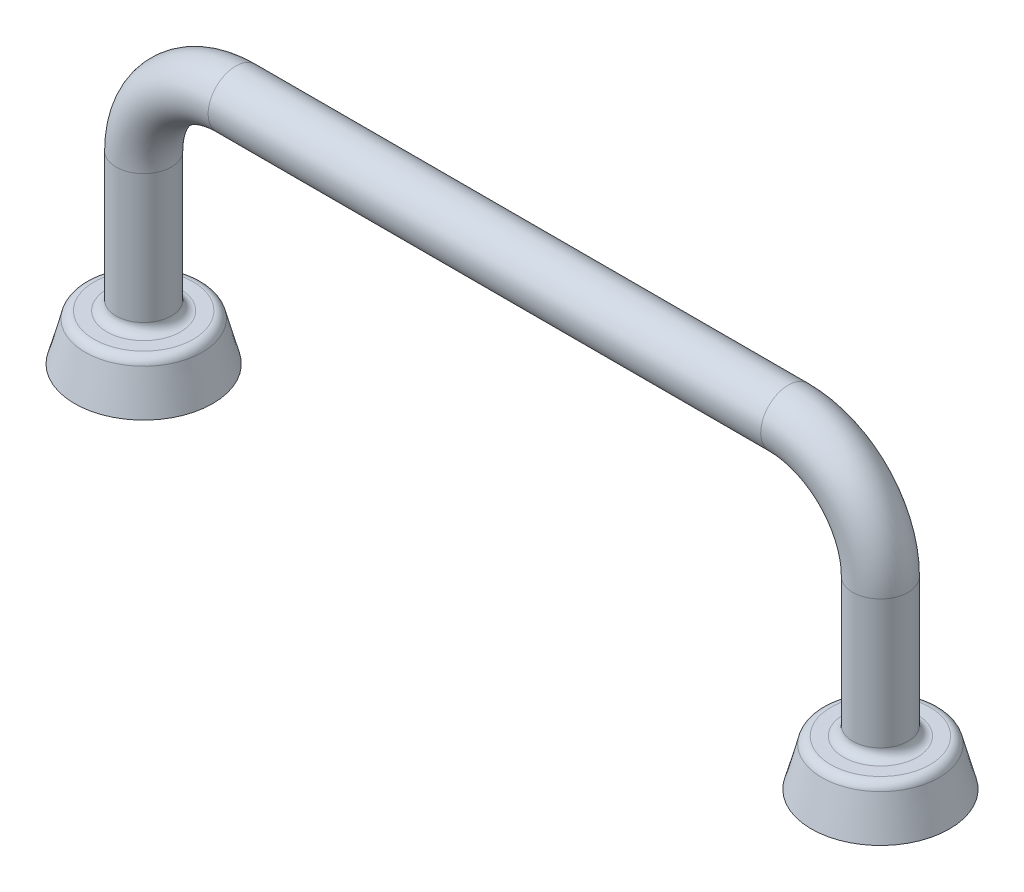
from build123d import *

# Parameters (mm, degrees)
SWEEP1_PROFILE_R              = 3
SKETCH10_R                    = 7.5
BOSS_EXTRUDE1_DEPTH           = 5
BOSS_EXTRUDE1_DRAFT           = -15
BOSS_EXTRUDE1_PROFILE_2_DEPTH = 5
BOSS_EXTRUDE1_PROFILE_2_DRAFT = -15
FILLET2_R                     = 1
M5X0_8_TAPPED_HOLE1_D         = 4.2
M5X0_8_TAPPED_HOLE1_DEPTH     = 10
M5X0_8_TAPPED_HOLE1_TIP       = 1.2618073
CHAMFER1_SIZE                 = 0.5


with BuildPart() as part:
    # Sweep1: sweep along a path in Sketch1
    with BuildLine(Plane.XY) as sweep1_path:
        Line((0, 0), (0, 20))
        ThreePointArc((0, 20), (-2.928932188, 27.071067812), (-10, 30))
        Line((-10, 30), (-70, 30))
        ThreePointArc((-70, 30), (-77.071067812, 27.071067812), (-80, 20))
        Line((-80, 20), (-80, 0))
    # Sweep1 profile (on start of the path) → Sweep1 (sweep)
    with BuildSketch(Plane.ZX):
        Circle(SWEEP1_PROFILE_R)
    sweep(path=sweep1_path.line)


with BuildPart() as boss_extrude1_tool:
    # Sketch10 → Boss-Extrude1 (with draft: the straight prism first)
    with BuildSketch(Plane.XZ):
        with Locations((-80, 0)):
            Circle(SKETCH10_R)
    extrude(amount=-BOSS_EXTRUDE1_DEPTH)
    # Boss-Extrude1: the draft: its side faces are tilted about the plane it starts from
    boss_extrude1_sides = [boss_extrude1_tool.faces().sort_by_distance(p)[0] for p in [
        (-87.5, 2.5, 0),
    ]]
    draft(boss_extrude1_sides, Plane.XZ, BOSS_EXTRUDE1_DRAFT)


with BuildPart() as part_1:
    add(part.part)

    # Boss-Extrude1: add boss_extrude1_tool
    add(boss_extrude1_tool.part)


with BuildPart() as boss_extrude1_profile_2_tool:
    # Sketch10 → Boss-Extrude1 profile 2 (with draft: the straight prism first)
    with BuildSketch(Plane.XZ):
        Circle(SKETCH10_R)
    extrude(amount=-BOSS_EXTRUDE1_PROFILE_2_DEPTH)
    # Boss-Extrude1 profile 2: the draft: its side faces are tilted about the plane it starts from
    boss_extrude1_profile_2_sides = [boss_extrude1_profile_2_tool.faces().sort_by_distance(p)[0] for p in [
        (-7.5, 2.5, 0),
    ]]
    draft(boss_extrude1_profile_2_sides, Plane.XZ, BOSS_EXTRUDE1_PROFILE_2_DRAFT)


with BuildPart() as part_2:
    add(part_1.part)

    # Boss-Extrude1 profile 2: add boss_extrude1_profile_2_tool
    add(boss_extrude1_profile_2_tool.part)

    # Fillet2
    fillet2_edges = [part_2.edges().sort_by_distance(p)[0] for p in [
        (-80, 5, -3),
        (-86.160254038, 5, 0),
        (0, 5, -3),
        (-6.160254038, 5, 0),
    ]]
    fillet(fillet2_edges, radius=FILLET2_R)

    # M5x0.8 Tapped Hole1
    with Locations(Plane(origin=(0, 0, 0), x_dir=(-1, 0, 0), z_dir=(0, -1, 0))):
        with Locations((80, 0), (0, 0)):
            Hole(M5X0_8_TAPPED_HOLE1_D / 2, depth=M5X0_8_TAPPED_HOLE1_DEPTH)
            with Locations((0, 0, -(M5X0_8_TAPPED_HOLE1_DEPTH + M5X0_8_TAPPED_HOLE1_TIP / 2))):  # 118° drill point
                Cone(0, M5X0_8_TAPPED_HOLE1_D / 2, M5X0_8_TAPPED_HOLE1_TIP, mode=Mode.SUBTRACT)

    # Chamfer1
    chamfer1_edges = [part_2.edges().sort_by_distance(p)[0] for p in [
        (-2.1, 0, 0),
        (-82.1, 0, 0),
    ]]
    chamfer(chamfer1_edges, length=CHAMFER1_SIZE)


solid = part_2.part
